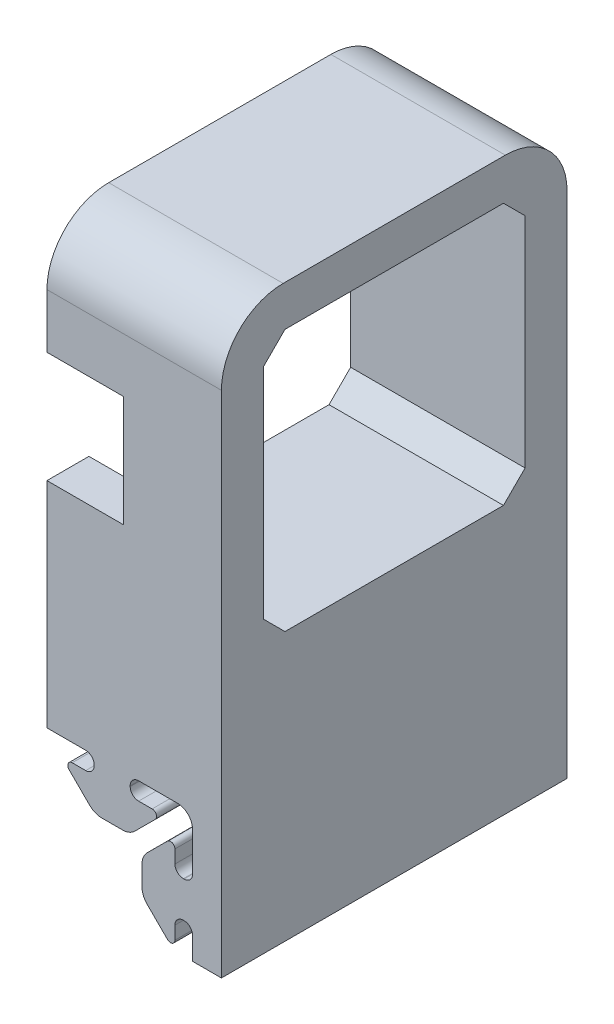
from build123d import *

# Parameters (mm, degrees)
BOSS_EXTRUDE1_DEPTH = 56
SKETCH14_W          = 42.4
SKETCH14_H          = 42.4
CUT_EXTRUDE1_DEPTH  = 56
CHAMFER1_SIZE       = 3.5
FILLET1_R           = 10
CUT_EXTRUDE4_REACH  = 104.922
SKETCH17_W          = 15.453545708
SKETCH17_H          = 18


with BuildPart() as part:
    # Sketch1 → Boss-Extrude1 (new body)
    with BuildSketch(Plane.XY):
        with BuildLine():
            Line((13.02, -7.9417418), (17.7, -7.9417418))
            Line((17.7, -7.9417418), (17.7, 84.52))
            Line((17.7, 84.52), (-10.566443095, 84.52))
            Line((-10.566443095, 84.52), (-10.566443095, 13.02))
            Line((-10.566443095, 13.02), (-5.317126718, 13.02))
            Line((-5.317126718, 13.02), (-4.287512407, 13.02))
            ThreePointArc((-4.287512407, 13.02), (-3.319474451, 12.619025549), (-2.9185, 11.650987593))
            Line((-2.9185, 11.650987593), (-2.9185, 11.539212407))
            ThreePointArc((-2.9185, 11.539212407), (-3.319474451, 10.571174451), (-4.287512407, 10.1702))
            Line((-4.287512407, 10.1702), (-6.476788598, 10.1702))
            ThreePointArc((-6.476788598, 10.1702), (-7.136510935, 9.729114651), (-6.981020848, 8.950903446))
            Line((-6.981020848, 8.950903446), (-3.672257405, 5.649701928))
            ThreePointArc((-3.672257405, 5.649701928), (-2.746830644, 5.032499411), (-1.655778399, 4.8158))
            Line((-1.655778399, 4.8158), (1.655778399, 4.8158))
            ThreePointArc((1.655778399, 4.8158), (2.746830644, 5.032499411), (3.672257405, 5.649701928))
            Line((3.672257405, 5.649701928), (6.981020848, 8.950903446))
            ThreePointArc((6.981020848, 8.950903446), (7.136510935, 9.729114651), (6.476788598, 10.1702))
            Line((6.476788598, 10.1702), (4.287512407, 10.1702))
            ThreePointArc((4.287512407, 10.1702), (3.319474451, 10.571174451), (2.9185, 11.539212407))
            Line((2.9185, 11.539212407), (2.9185, 11.650987593))
            ThreePointArc((2.9185, 11.650987593), (3.319474451, 12.619025549), (4.287512407, 13.02))
            Line((4.287512407, 13.02), (6.332886163, 13.02))
            Line((6.332886163, 13.02), (10.562594215, 13.019824354))
            ThreePointArc((10.562594215, 13.019824354), (12.303594776, 12.313982883), (13.019956614, 10.577284622))
            Line((13.019956614, 10.577284622), (13.02, 4.287469289))
            ThreePointArc((13.02, 4.287469289), (12.619025549, 3.319431332), (11.650987593, 2.918456882))
            Line((11.650987593, 2.918456882), (11.539212407, 2.918456882))
            ThreePointArc((11.539212407, 2.918456882), (10.571174451, 3.319431332), (10.1702, 4.287469289))
            Line((10.1702, 4.287469289), (10.1702, 6.402089023))
            ThreePointArc((10.1702, 6.402089023), (9.733877283, 7.055496588), (8.963146507, 6.90287605))
            Line((8.963146507, 6.90287605), (5.667020993, 3.614283579))
            ThreePointArc((5.667020993, 3.614283579), (5.046449321, 2.687255303), (4.8285, 1.593185507))
            Line((4.8285, 1.593185507), (4.8285, -1.593185507))
            ThreePointArc((4.8285, -1.593185507), (5.046449321, -2.687255303), (5.667020993, -3.614283579))
            Line((5.667020993, -3.614283579), (8.963146507, -6.90287605))
            ThreePointArc((8.963146507, -6.90287605), (9.733877283, -7.055496588), (10.1702, -6.402089023))
            Line((10.1702, -6.402089023), (10.1702, -4.287469289))
            ThreePointArc((10.1702, -4.287469289), (10.571174451, -3.319431332), (11.539212407, -2.918456882))
            Line((11.539212407, -2.918456882), (11.650987593, -2.918456882))
            ThreePointArc((11.650987593, -2.918456882), (12.619025549, -3.319431332), (13.02, -4.287469289))
            Line((13.02, -4.287469289), (13.02, -5.3170836))
            Line((13.02, -5.3170836), (13.02, -7.9417418))
        make_face()
    extrude(amount=BOSS_EXTRUDE1_DEPTH)

    # Sketch14 → Cut-Extrude1 (cut)
    with BuildSketch(Plane(origin=(17.7, 0, 0), x_dir=(0, 0, -1), z_dir=(1, 0, 0))):
        with Locations((-28, 56.72)):
            Rectangle(SKETCH14_W, SKETCH14_H)
    extrude(amount=-CUT_EXTRUDE1_DEPTH, mode=Mode.SUBTRACT)

    # Chamfer1
    chamfer1_edges = [part.edges().sort_by_distance(p)[0] for p in [
        (3.566778452, 35.52, 49.2),
        (3.566778452, 77.92, 49.2),
        (3.566778452, 77.92, 6.8),
        (3.566778452, 35.52, 6.8),
    ]]
    chamfer(chamfer1_edges, length=CHAMFER1_SIZE)

    # Fillet1
    fillet1_edges = [part.edges().sort_by_distance(p)[0] for p in [
        (3.566778452, 84.52, 56),
        (3.566778452, 84.52, 0),
    ]]
    fillet(fillet1_edges, radius=FILLET1_R)

    # Sketch17 → Cut-Extrude4 (cut, up to next)
    with BuildSketch(Plane.XY.offset(56), mode=Mode.PRIVATE) as cut_extrude4_sk1:
        with Locations((-5.893215949, 56.72)):
            Rectangle(SKETCH17_W, SKETCH17_H)
    cut_extrude4_tool1 = extrude(cut_extrude4_sk1.sketch, amount=-CUT_EXTRUDE4_REACH, mode=Mode.PRIVATE) & part.part
    add(cut_extrude4_tool1.solids().sort_by_distance((-5.893216, 56.72, 56))[0], mode=Mode.SUBTRACT)


solid = part.part
